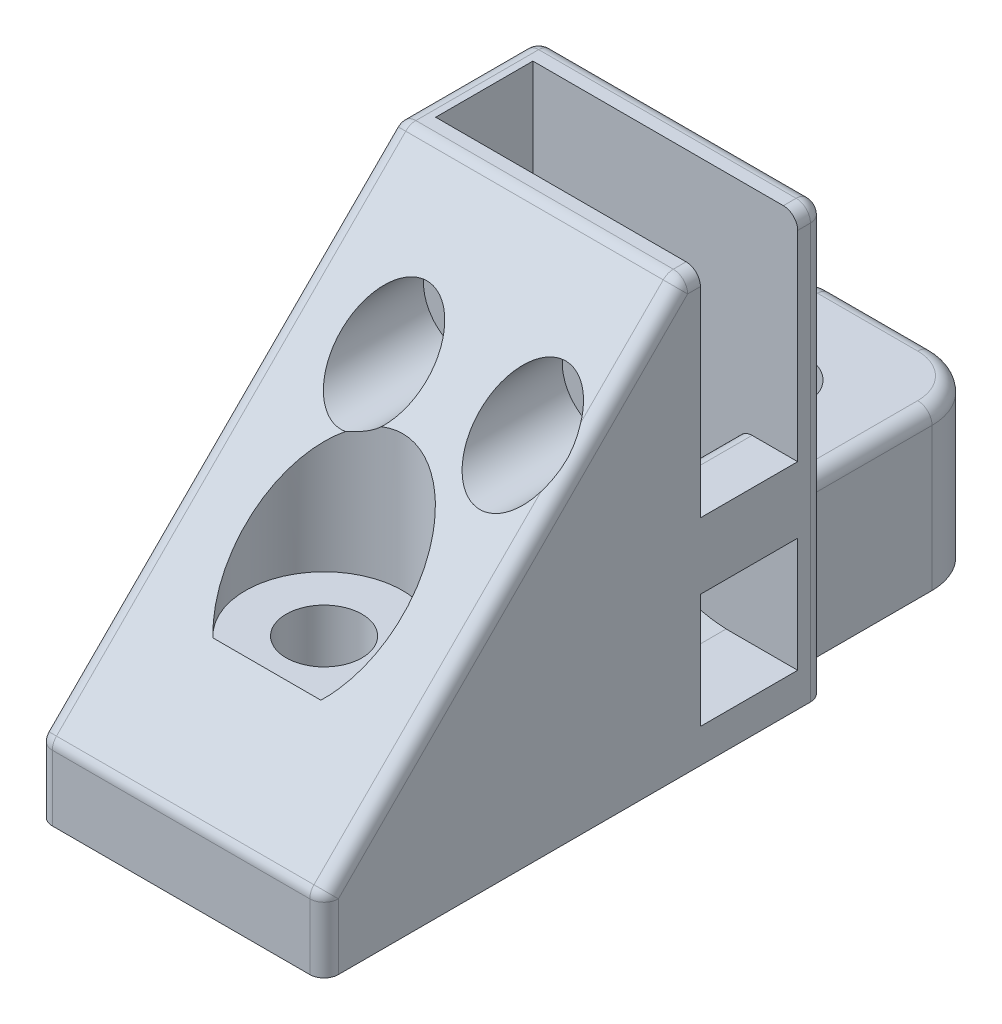
from build123d import *

# Parameters (mm, degrees)
SKETCH1_W               = 20
SKETCH1_H               = 35
BOSS_EXTRUDE1_DEPTH     = 30
CHAMFER1_SIZE           = 25
FILLET1_R               = 1
SKETCH2_R               = 2.65
CUT_EXTRUDE2_DEPTH      = 20
SKETCH4_R               = 5.5
CUT_EXTRUDE3_DEPTH      = 20
SKETCH5_W               = 20.05
SKETCH5_H               = 6.8
CUT_EXTRUDE4_DEPTH      = 15
CUT_EXTRUDE5_DEPTH      = 6.8
FILLET3_R               = 1
SKETCH7_R               = 2.745697614
BOSS_EXTRUDE2_DEPTH     = 11
FILLET4_R               = 1
SKETCH10_R              = 1.65
CUT_EXTRUDE7_DEPTH      = 18
CUT_EXTRUDE8_DEPTH      = 8
CUT_EXTRUDE8_DEPTH_BACK = 8
SKETCH11_R              = 3


with BuildPart() as part:
    # Sketch1 → Boss-Extrude1 (new body)
    with BuildSketch(Plane(origin=(0, 0, 0), x_dir=(1, 0, 0), z_dir=(0, 1, 0))):
        Rectangle(SKETCH1_W, SKETCH1_H)
    extrude(amount=BOSS_EXTRUDE1_DEPTH)

    # Chamfer1
    chamfer1_edges = [part.edges().sort_by_distance(p)[0] for p in [
        (0, 30, 17.5),
    ]]
    chamfer(chamfer1_edges, length=CHAMFER1_SIZE)

    # Fillet1
    fillet1_edges = [part.edges().sort_by_distance(p)[0] for p in [
        (10, 30, -12.5),
        (0, 30, -7.5),
        (10, 2.5, 17.5),
        (10, 17.5, 5),
        (-10, 2.5, 17.5),
        (0, 5, 17.5),
        (0, 30, -17.5),
        (-10, 17.5, 5),
        (-10, 30, -12.5),
        (-10, 15, -17.5),
        (10, 15, -17.5),
    ]]
    fillet(fillet1_edges, radius=FILLET1_R)

    # Sketch2 → Cut-Extrude2 (cut)
    with BuildSketch(Plane(origin=(0, 0, 0), x_dir=(-1, 0, 0), z_dir=(0, -1, 0))):
        with Locations(Location((0, -7.5, 0), (0, 0, 90))):
            Circle(SKETCH2_R)
    extrude(amount=-CUT_EXTRUDE2_DEPTH, mode=Mode.SUBTRACT)

    # Sketch4 → Cut-Extrude3 (cut)
    with BuildSketch(Plane(origin=(0, 11, 0), x_dir=(-1, 0, 0), z_dir=(0, -1, 0))):
        with Locations((0, -7.5)):
            Circle(SKETCH4_R)
    extrude(amount=-CUT_EXTRUDE3_DEPTH, mode=Mode.SUBTRACT)

    # Sketch5 → Cut-Extrude4 (cut)
    with BuildSketch(Plane(origin=(0, 30, 0), x_dir=(1, 0, 0), z_dir=(0, 1, 0))):
        with Locations((1.516964354, 12.207106781)):
            Rectangle(SKETCH5_W, SKETCH5_H)
    extrude(amount=-CUT_EXTRUDE4_DEPTH, mode=Mode.SUBTRACT)

    # Sketch6 → Cut-Extrude5 (cut)
    with BuildSketch(Plane(origin=(0, 0, -8.807106781), x_dir=(-1, 0, 0), z_dir=(0, 0, -1))):
        with BuildLine():
            Line((-10, 10.37003714), (-10, 2.37003714))
            Line((-10, 2.37003714), (-5, 2.37003714))
            ThreePointArc((-5, 2.37003714), (1.70481367, 5.469731724), (4.254017823, 12.402565997))
            Line((4.254017823, 12.402565997), (4.254017823, 21.00909074))
            Line((4.254017823, 21.00909074), (-5.745982177, 21.00909074))
            Line((-5.745982177, 21.00909074), (-5.745982177, 14.664154296))
            ThreePointArc((-5.745982177, 14.664154296), (-6.989544506, 11.641898939), (-10, 10.37003714))
        make_face()
    extrude(amount=CUT_EXTRUDE5_DEPTH, mode=Mode.SUBTRACT)

    # Fillet3
    fillet3_edges = [part.edges().sort_by_distance(p)[0] for p in [
        (5.745982177, 15, -12.207106781),
        (-4.254017823, 15, -12.207106781),
    ]]
    fillet(fillet3_edges, radius=FILLET3_R)

    # Sketch7 → Boss-Extrude2 (add)
    with BuildSketch(Plane.XZ):
        with BuildLine():
            Line((7.5, -17.5), (-7.5, -17.5))
            Line((-7.5, -17.5), (-7.5, -27.5))
            ThreePointArc((-7.5, -27.5), (-6.328427125, -30.328427125), (-3.5, -31.5))
            Line((-3.5, -31.5), (3.5, -31.5))
            ThreePointArc((3.5, -31.5), (6.328427125, -30.328427125), (7.5, -27.5))
            Line((7.5, -27.5), (7.5, -17.5))
        make_face()
        with Locations(Location((0, -23.5, 0), (0, 0, 270))):
            Circle(SKETCH7_R, mode=Mode.SUBTRACT)
    extrude(amount=-BOSS_EXTRUDE2_DEPTH)

    # Fillet4
    fillet4_edges = [part.edges().sort_by_distance(p)[0] for p in [
        (6.328427125, 11, -30.328427125),
        (0, 11, -31.5),
        (-6.328427125, 11, -30.328427125),
        (-7.5, 11, -22.5),
        (7.5, 11, -22.5),
    ]]
    fillet(fillet4_edges, radius=FILLET4_R)

    # Sketch10 → Cut-Extrude7 (cut)
    with BuildSketch(Plane.XY.offset(-15.607106781)):
        with Locations(Location((-3.358035646, 22.55, 0), (0, 0, 90))):
            Circle(SKETCH10_R)
        with Locations(Location((6.341964354, 22.55, 0), (0, 0, 90))):
            Circle(SKETCH10_R)
    extrude(amount=CUT_EXTRUDE7_DEPTH, mode=Mode.SUBTRACT)

    # Sketch11 → Cut-Extrude8 (cut, two sides: drawn at the far end of the back side and taken through both)
    with BuildSketch(Plane(origin=(0, 0, 2.192893219), x_dir=(-1, 0, 0), z_dir=(0, 0, -1)).offset(-CUT_EXTRUDE8_DEPTH_BACK)):
        with Locations(Location((3.358035646, 22.55, 0), (0, 0, 227.566705352))):
            Circle(SKETCH11_R)
        with Locations(Location((-6.341964354, 22.55, 0), (0, 0, 207.623697814))):
            Circle(SKETCH11_R)
    extrude(amount=CUT_EXTRUDE8_DEPTH + CUT_EXTRUDE8_DEPTH_BACK, mode=Mode.SUBTRACT)


solid = part.part
